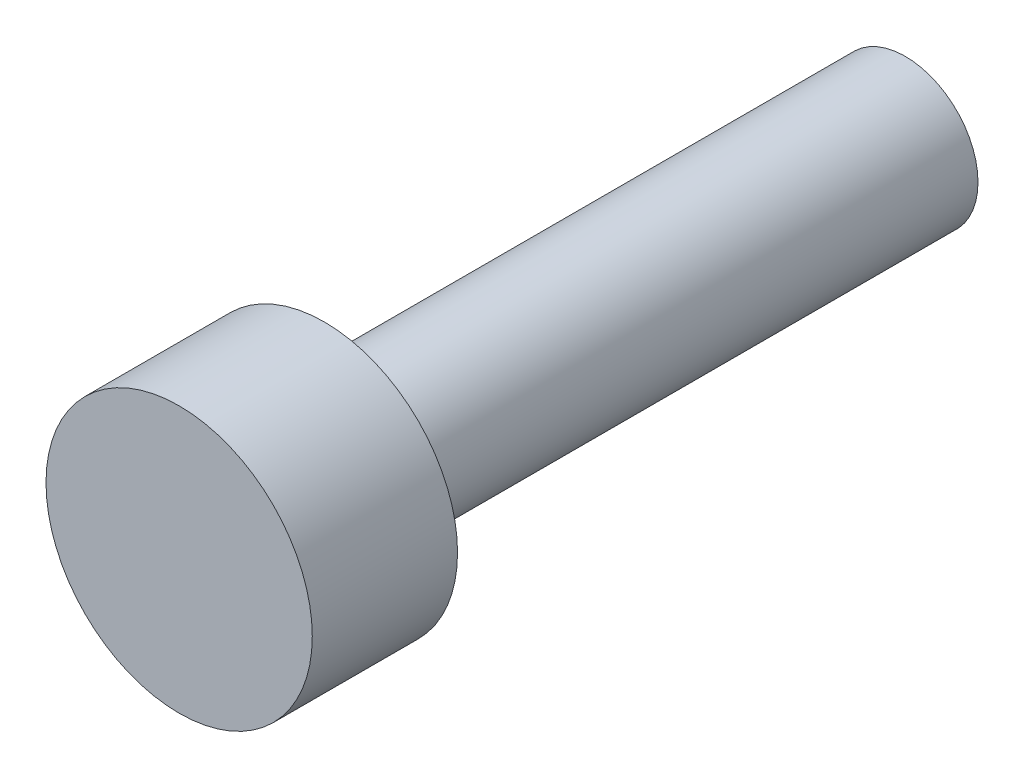
from build123d import *

# Parameters (mm, degrees)
SKETCH1_R           = 1.5
BOSS_EXTRUDE1_DEPTH = 12
SKETCH2_R           = 2.75
BOSS_EXTRUDE2_DEPTH = 3


with BuildPart() as part:
    # Sketch1 → Boss-Extrude1 (new body)
    with BuildSketch(Plane.XY):
        Circle(SKETCH1_R)
    extrude(amount=BOSS_EXTRUDE1_DEPTH)

    # Sketch2 → Boss-Extrude2 (add)
    with BuildSketch(Plane.XY.offset(12)):
        Circle(SKETCH2_R)
    extrude(amount=BOSS_EXTRUDE2_DEPTH)


solid = part.part
